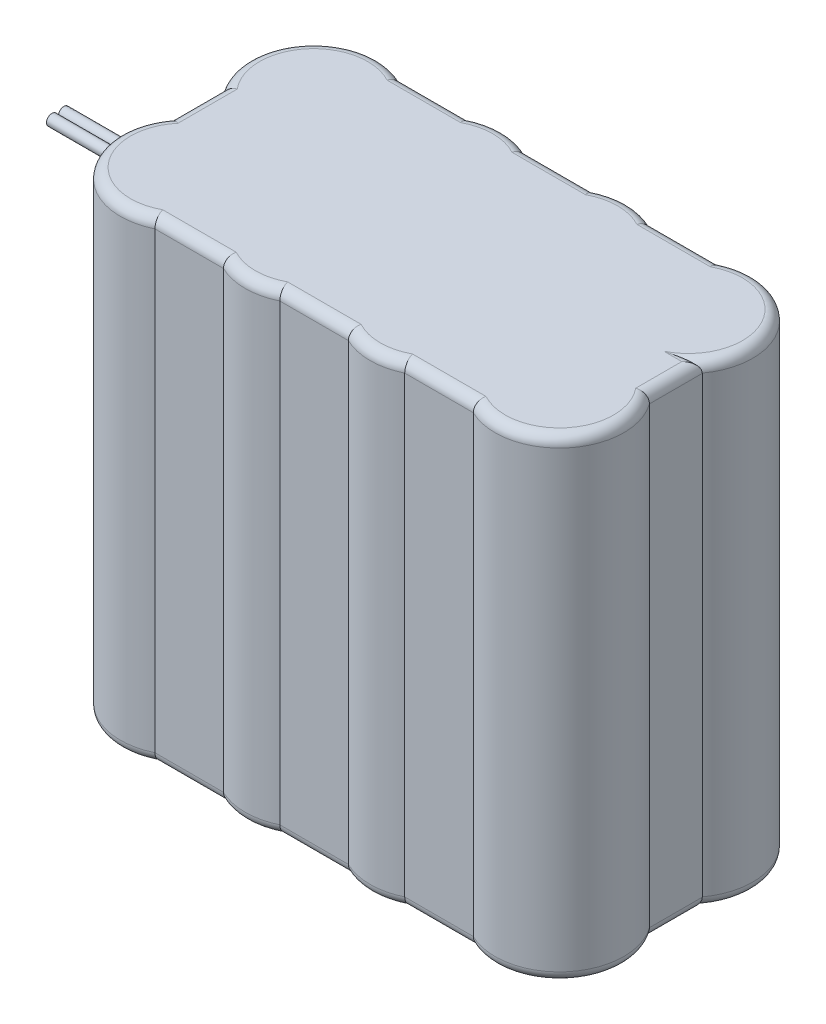
from build123d import *

# Parameters (mm, degrees)
BOSS_EXTRUDE1_DEPTH      = 69.5
FILLET1_R                = 1.5
BOSS_EXTRUDE4_DEPTH      = 10
BOSS_EXTRUDE4_DEPTH_BACK = 10
SKETCH6_R                = 0.8


with BuildPart() as part:
    # Sketch2 → Boss-Extrude1 (new body)
    with BuildSketch(Plane(origin=(0, 0, 0), x_dir=(1, 0, 0), z_dir=(0, 1, 0))):
        with BuildLine():
            Line((4.730532722, 121.885982712), (-5.320532722, 121.885982712))
            ThreePointArc((-5.320532722, 121.885982712), (-9.45, 122.835982712), (-13.579467278, 121.885982712))
            Line((-13.579467278, 121.885982712), (-23.630532722, 121.885982712))
            ThreePointArc((-23.630532722, 121.885982712), (-27.76, 122.835982712), (-31.889467278, 121.885982712))
            Line((-31.889467278, 121.885982712), (-41.940532722, 121.885982712))
            ThreePointArc((-41.940532722, 121.885982712), (-53.342457764, 119.42037233), (-53.662287572, 107.759290129))
            Line((-53.662287572, 107.759290129), (-53.662287572, 100.112675295))
            ThreePointArc((-53.662287572, 100.112675295), (-53.342457764, 88.451593093), (-41.940532722, 85.985982712))
            Line((-41.940532722, 85.985982712), (-31.889467278, 85.985982712))
            ThreePointArc((-31.889467278, 85.985982712), (-27.76, 85.035982712), (-23.630532722, 85.985982712))
            Line((-23.630532722, 85.985982712), (-13.579467278, 85.985982712))
            ThreePointArc((-13.579467278, 85.985982712), (-9.45, 85.035982712), (-5.320532722, 85.985982712))
            Line((-5.320532722, 85.985982712), (4.730532722, 85.985982712))
            ThreePointArc((4.730532722, 85.985982712), (16.094379198, 88.405994421), (16.522429884, 100.016775447))
            Line((16.522429884, 100.016775447), (16.522429884, 107.759290129))
            Line((16.522429884, 107.759290129), (16.452287572, 107.759290129))
            ThreePointArc((16.452287572, 107.759290129), (16.132457764, 119.42037233), (4.730532722, 121.885982712))
        make_face()
    extrude(amount=BOSS_EXTRUDE1_DEPTH)

    # Fillet1
    fillet1_edges = [part.edges().sort_by_distance(p)[0] for p in [
        (-9.45, 69.5, -122.835982712),
        (-9.45, 0, -122.835982712),
        (16.132457764, 69.5, -119.42037233),
        (16.132457764, 0, -119.42037233),
        (16.522429884, 69.5, -103.888032788),
        (16.487358728, 69.5, -107.759290129),
        (-53.662287572, 69.5, -103.935982712),
        (16.522429884, 0, -103.888032788),
        (16.487358728, 0, -107.759290129),
        (-53.662287572, 0, -103.935982712),
        (-0.295, 69.5, -121.885982712),
        (-0.295, 0, -121.885982712),
        (-18.605, 69.5, -121.885982712),
        (-18.605, 0, -121.885982712),
        (-36.915, 69.5, -121.885982712),
        (-36.915, 0, -121.885982712),
        (-0.295, 69.5, -85.985982712),
        (-0.295, 0, -85.985982712),
        (-36.915, 69.5, -85.985982712),
        (-36.915, 0, -85.985982712),
        (-18.605, 69.5, -85.985982712),
        (-18.605, 0, -85.985982712),
        (16.094379198, 69.5, -88.405994421),
        (16.094379198, 0, -88.405994421),
        (-9.45, 69.5, -85.035982712),
        (-9.45, 0, -85.035982712),
        (-27.76, 69.5, -85.035982712),
        (-27.76, 0, -85.035982712),
        (-53.342457764, 69.5, -88.451593093),
        (-53.342457764, 0, -88.451593093),
        (-53.342457764, 69.5, -119.42037233),
        (-53.342457764, 0, -119.42037233),
        (-27.76, 69.5, -122.835982712),
        (-27.76, 0, -122.835982712),
    ]]
    fillet(fillet1_edges, radius=FILLET1_R)

    # Sketch6 → Boss-Extrude4 (add, two sides: drawn at the far end of the back side and taken through both)
    with BuildSketch(Plane.ZY.offset(54.662287572).offset(-BOSS_EXTRUDE4_DEPTH_BACK)):
        with Locations((-95.360982712, 66.7)):
            Circle(SKETCH6_R)
        with Locations((-93.610982712, 66.7)):
            Circle(SKETCH6_R)
    extrude(amount=BOSS_EXTRUDE4_DEPTH + BOSS_EXTRUDE4_DEPTH_BACK)


solid = part.part
